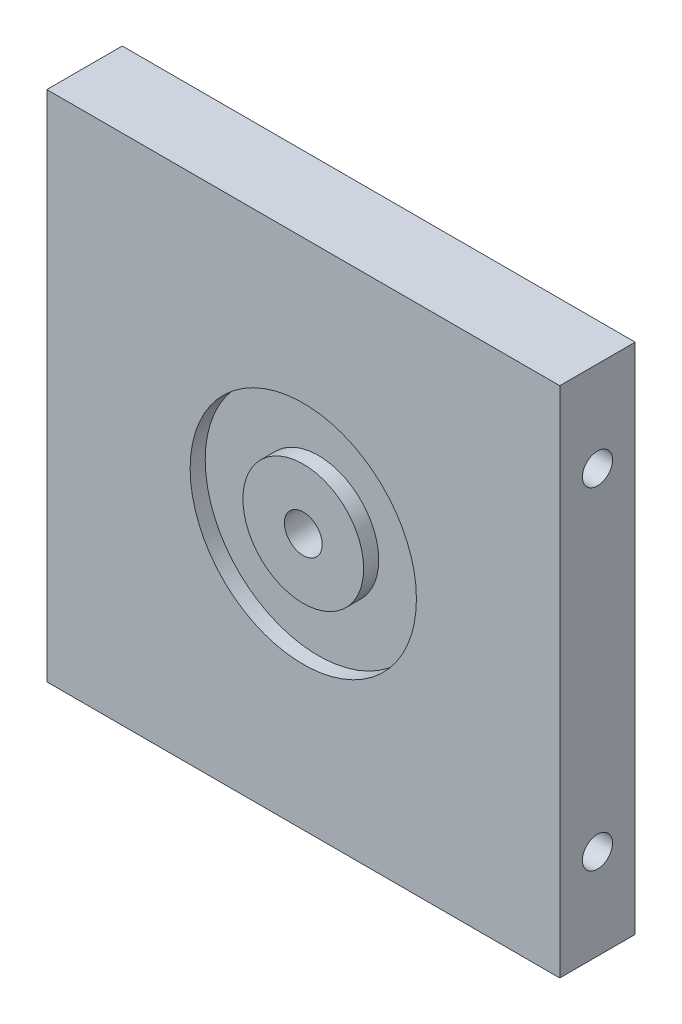
from build123d import *

# Parameters (mm, degrees)
ESBO_O1_W                = 34
ESBO_O1_H                = 34
RESSALTO_EXTRUS_O1_DEPTH = 2.5
ESBO_O2_R                = 7.5
ESBO_O2_R_2              = 4
CORTE_EXTRUS_O1_DEPTH    = 1
ESBO_O3_R                = 1.25
CORTE_EXTRUS_O2_DEPTH    = 5
ESBO_O4_R                = 1
CORTE_EXTRUS_O3_DEPTH    = 10


with BuildPart() as part:
    # Esboço1 → Ressalto-extrusão1 (new, symmetric)
    with BuildSketch(Plane.XY):
        Rectangle(ESBO_O1_W, ESBO_O1_H)
    extrude(amount=RESSALTO_EXTRUS_O1_DEPTH, both=True)

    # Esboço2 → Corte-extrusão1 (cut)
    with BuildSketch(Plane.XY.offset(2.5)):
        Circle(ESBO_O2_R)
        Circle(ESBO_O2_R_2, mode=Mode.SUBTRACT)
    extrude(amount=-CORTE_EXTRUS_O1_DEPTH, mode=Mode.SUBTRACT)

    # Esboço3 → Corte-extrusão2 (cut)
    with BuildSketch(Plane.XY.offset(2.5)):
        Circle(ESBO_O3_R)
    extrude(amount=-CORTE_EXTRUS_O2_DEPTH, mode=Mode.SUBTRACT)

    # Esboço4 → Corte-extrusão3 (cut)
    with BuildSketch(Plane.ZY.offset(17)):
        with Locations((0, 11)):
            Circle(ESBO_O4_R)
        with Locations((0, -11)):
            Circle(ESBO_O4_R)
    corte_extrus_o3 = extrude(amount=-CORTE_EXTRUS_O3_DEPTH, mode=Mode.SUBTRACT)

    # Espelhar1: Corte-extrusão3 across plane
    add(corte_extrus_o3.mirror(Plane(origin=(0, 0, 0), x_dir=(0, 0, 1), z_dir=(1, 0, 0))), mode=Mode.SUBTRACT)


solid = part.part
